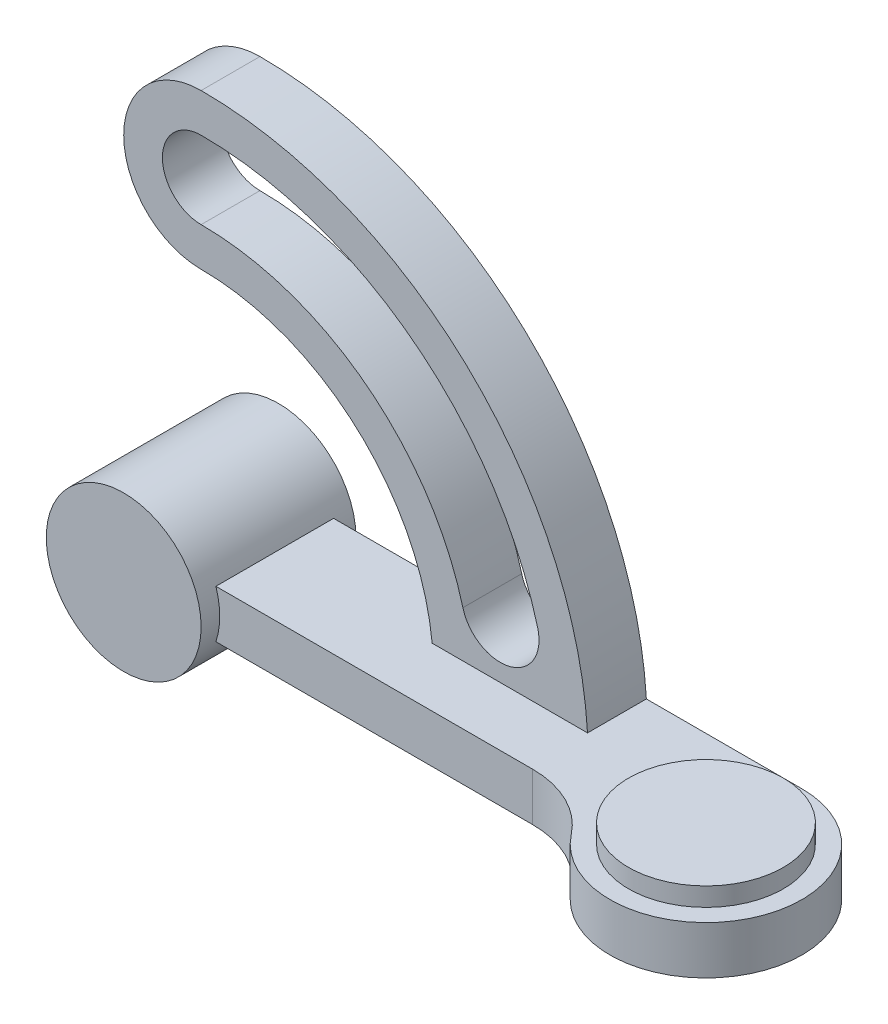
from build123d import *

# Parameters (mm, degrees)
SALIENTE_EXTRUIR1_DEPTH      = 7.874
SALIENTE_EXTRUIR2_DEPTH      = 12.7
SALIENTE_EXTRUIR2_DEPTH_BACK = 12.7
CROQUIS4_R                   = 12.7
SALIENTE_EXTRUIR4_DEPTH      = 9.652
CORTAR_EXTRUIR1_DEPTH        = 9.652
CROQUIS10_R                  = 12.7
SALIENTE_EXTRUIR5_DEPTH      = 3.048


with BuildPart() as part:
    # Croquis2 → Saliente-Extruir1 (new body)
    with BuildSketch(Plane(origin=(0, 0, 0), x_dir=(1, 0, 0), z_dir=(0, 1, 0))):
        with BuildLine():
            Line((0, 15.748), (-88.9, 15.748))
            Line((-88.9, 15.748), (-88.9, -3.556))
            Line((-88.9, -3.556), (-24.886815787, -3.556))
            ThreePointArc((-24.886815787, -3.556), (-17.958619485, -5.161878518), (-12.443407893, -9.652))
            ThreePointArc((-12.443407893, -9.652), (14.142121482, -6.928196302), (0, 15.748))
        make_face()
    extrude(amount=SALIENTE_EXTRUIR1_DEPTH)

    # Croquis4 → Saliente-Extruir2 (add, two sides: drawn at the far end of the back side and taken through both)
    with BuildSketch(Plane.XY.offset(-6.096).offset(-SALIENTE_EXTRUIR2_DEPTH_BACK)):
        with Locations((-88.9, 3.937)):
            Circle(CROQUIS4_R)
    extrude(amount=SALIENTE_EXTRUIR2_DEPTH + SALIENTE_EXTRUIR2_DEPTH_BACK)

    # Croquis8 → Saliente-Extruir4 (add)
    with BuildSketch(Plane.XY.offset(-6.096)):
        with BuildLine():
            Line((-51.003957581, 7.874), (-25.522164513, 7.874))
            ThreePointArc((-25.522164513, 7.874), (-45.412930083, 50.209289224), (-88.9, 67.437))
            ThreePointArc((-88.9, 67.437), (-101.6, 54.737), (-88.9, 42.037))
            ThreePointArc((-88.9, 42.037), (-63.389117028, 32.235495543), (-51.003957581, 7.874))
        make_face()
    extrude(amount=-SALIENTE_EXTRUIR4_DEPTH)

    # Croquis9 → Cortar-Extruir1 (cut)
    with BuildSketch(Plane.XY.offset(-6.096)):
        with BuildLine():
            ThreePointArc((-88.9, 61.087), (-95.25, 54.737), (-88.9, 48.387))
            ThreePointArc((-88.9, 48.387), (-61.840554481, 39.201555976), (-45.964597021, 15.441506555))
            ThreePointArc((-45.964597021, 15.441506555), (-38.187467088, 10.951378494), (-33.697339028, 18.728508428))
            ThreePointArc((-33.697339028, 18.728508428), (-54.109284332, 49.277143398), (-88.9, 61.087))
        make_face()
    extrude(amount=-CORTAR_EXTRUIR1_DEPTH, mode=Mode.SUBTRACT)

    # Croquis10 → Saliente-Extruir5 (add)
    with BuildSketch(Plane(origin=(0, 7.874, 0), x_dir=(1, 0, 0), z_dir=(0, 1, 0))):
        with Locations(Location((0, 0, 0), (0, 0, 90))):
            Circle(CROQUIS10_R)
    extrude(amount=SALIENTE_EXTRUIR5_DEPTH)


solid = part.part
